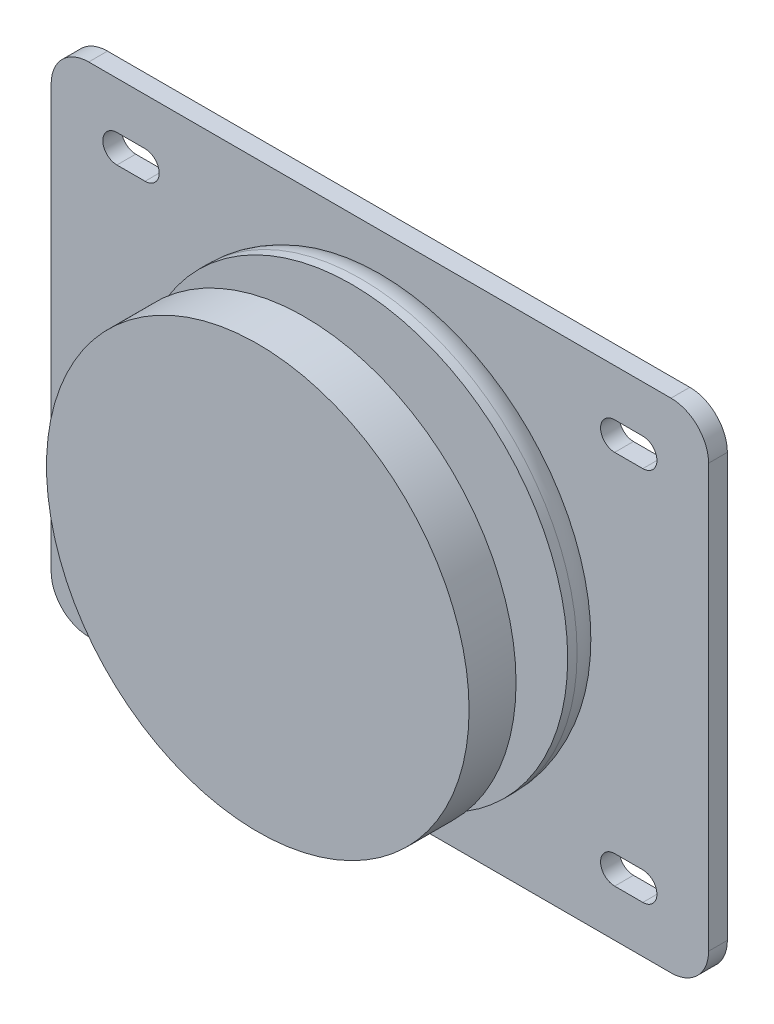
from build123d import *

# Parameters (mm, degrees)
SKETCH_1_R          = 23
EXTRUDE_1_DEPTH     = 5
FILLET_1_R          = 4
EXTRUDE_2_DEPTH     = 2
CUT_EXTRUDE_3_DEPTH = 45.18427322
SKETCH_7_R          = 14
EXTRUDE_3_DEPTH     = 5
SKETCH_8_R          = 22.5
EXTRUDE_4_DEPTH     = 5


with BuildPart() as part:
    # 草图1 → 凸台-拉伸1 (new body)
    with BuildSketch(Plane.XY):
        Circle(SKETCH_1_R)
    extrude(amount=EXTRUDE_1_DEPTH)

    # 圆角1
    fillet_1_edges = [part.edges().sort_by_distance(p)[0] for p in [
        (-23, 0, 0),
    ]]
    fillet(fillet_1_edges, radius=FILLET_1_R)

    # 草图4 → 凸台-拉伸2 (add)
    with BuildSketch(Plane.XY):
        with BuildLine():
            Line((-31, -26.5), (31, -26.5))
            ThreePointArc((31, -26.5), (33.828427125, -25.328427125), (35, -22.5))
            Line((35, -22.5), (35, 22.5))
            ThreePointArc((35, 22.5), (33.828427125, 25.328427125), (31, 26.5))
            Line((31, 26.5), (-31, 26.5))
            ThreePointArc((-31, 26.5), (-33.828427125, 25.328427125), (-35, 22.5))
            Line((-35, 22.5), (-35, -22.5))
            ThreePointArc((-35, -22.5), (-33.828427125, -25.328427125), (-31, -26.5))
        make_face()
    extrude(amount=EXTRUDE_2_DEPTH)

    # 草图6 → 切除-拉伸3 (cut, through all)
    with BuildSketch(Plane(origin=(0, 0, 0), x_dir=(-1, 0, 0), z_dir=(0, 0, -1))):
        with BuildLine():
            Line((28, 21.5), (25, 21.5))
            ThreePointArc((25, 21.5), (23.5, 20), (25, 18.5))
            Line((25, 18.5), (28, 18.5))
            ThreePointArc((28, 18.5), (29.5, 20), (28, 21.5))
        make_face()
        with BuildLine():
            Line((25, -18.5), (28, -18.5))
            ThreePointArc((28, -18.5), (29.5, -20), (28, -21.5))
            Line((28, -21.5), (25, -21.5))
            ThreePointArc((25, -21.5), (23.5, -20), (25, -18.5))
        make_face()
        with BuildLine():
            Line((-28, -21.5), (-25, -21.5))
            ThreePointArc((-25, -21.5), (-23.5, -20), (-25, -18.5))
            Line((-25, -18.5), (-28, -18.5))
            ThreePointArc((-28, -18.5), (-29.5, -20), (-28, -21.5))
        make_face()
        with BuildLine():
            Line((-28, 21.5), (-25, 21.5))
            ThreePointArc((-25, 21.5), (-23.5, 20), (-25, 18.5))
            Line((-25, 18.5), (-28, 18.5))
            ThreePointArc((-28, 18.5), (-29.5, 20), (-28, 21.5))
        make_face()
    extrude(amount=-CUT_EXTRUDE_3_DEPTH, mode=Mode.SUBTRACT)

    # 草图7 → 凸台-拉伸3 (add)
    with BuildSketch(Plane.XY.offset(5)):
        Circle(SKETCH_7_R)
    extrude(amount=EXTRUDE_3_DEPTH)

    # 草图8 → 凸台-拉伸4 (add)
    with BuildSketch(Plane.XY.offset(10)):
        Circle(SKETCH_8_R)
    extrude(amount=EXTRUDE_4_DEPTH)


solid = part.part
